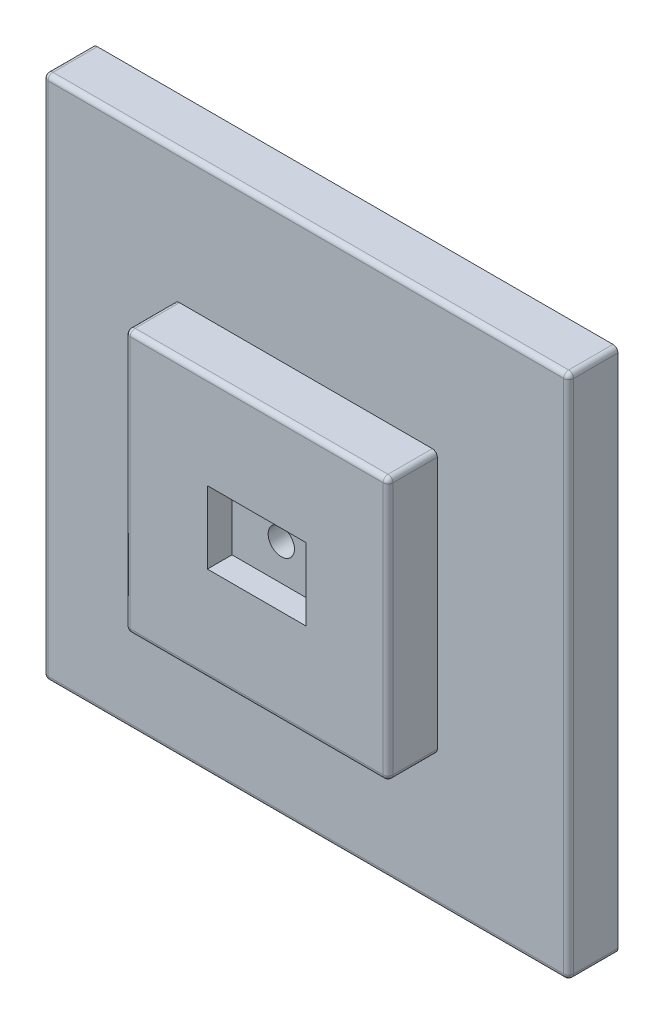
from build123d import *

# Parameters (mm, degrees)
SKETCH1_W           = 160
SKETCH1_H           = 160
SKETCH1_W_2         = 80
SKETCH1_H_2         = 80
BOSS_EXTRUDE1_DEPTH = 15
SKETCH1_5_W         = 80
SKETCH1_5_H         = 80
BOSS_EXTRUDE2_DEPTH = 30
SKETCH1_6_W         = 30
SKETCH1_6_H         = 22
BOSS_EXTRUDE3_DEPTH = 22.5
SKETCH2_R           = 4
CUT_EXTRUDE2_DEPTH  = 22.5
SKETCH3_R           = 7.5
CUT_EXTRUDE3_DEPTH  = 5
FILLET1_R           = 1.5


with BuildPart() as part:
    # Sketch1 → Boss-Extrude1 (new body)
    with BuildSketch(Plane.XY):
        with Locations((80, 80)):
            Rectangle(SKETCH1_W, SKETCH1_H)
        with Locations((80, 80)):
            Rectangle(SKETCH1_W_2, SKETCH1_H_2, mode=Mode.SUBTRACT)
    extrude(amount=BOSS_EXTRUDE1_DEPTH)

    # Sketch1<5> → Boss-Extrude2 (add)
    with BuildSketch(Plane.XY):
        with Locations((80, 80)):
            Rectangle(SKETCH1_5_W, SKETCH1_5_H)
        Polygon((65, 91), (80, 91), (95, 91), (95, 69), (80, 69), (65, 69), align=None, mode=Mode.SUBTRACT)
    extrude(amount=BOSS_EXTRUDE2_DEPTH)

    # Sketch1<6> → Boss-Extrude3 (add)
    with BuildSketch(Plane.XY):
        with Locations((80, 80)):
            Rectangle(SKETCH1_6_W, SKETCH1_6_H)
    extrude(amount=BOSS_EXTRUDE3_DEPTH)

    # Sketch2 → Cut-Extrude2 (cut)
    with BuildSketch(Plane.XY.offset(22.5)):
        with Locations((80, 80)):
            Circle(SKETCH2_R)
    extrude(amount=-CUT_EXTRUDE2_DEPTH, mode=Mode.SUBTRACT)

    # Sketch3 → Cut-Extrude3 (cut)
    with BuildSketch(Plane(origin=(0, 0, 0), x_dir=(-1, 0, 0), z_dir=(0, 0, -1))):
        with Locations((-80, 80)):
            Circle(SKETCH3_R)
    extrude(amount=-CUT_EXTRUDE3_DEPTH, mode=Mode.SUBTRACT)

    # Fillet1
    fillet1_edges = [part.edges().sort_by_distance(p)[0] for p in [
        (0, 0, 7.5),
        (80, 0, 15),
        (160, 0, 7.5),
        (160, 160, 7.5),
        (160, 80, 15),
        (0, 160, 7.5),
        (80, 160, 15),
        (0, 80, 15),
        (40, 40, 22.5),
        (40, 120, 22.5),
        (120, 120, 22.5),
        (120, 40, 22.5),
        (40, 80, 30),
        (120, 80, 30),
        (80, 120, 30),
        (80, 40, 30),
    ]]
    fillet(fillet1_edges, radius=FILLET1_R)


solid = part.part
